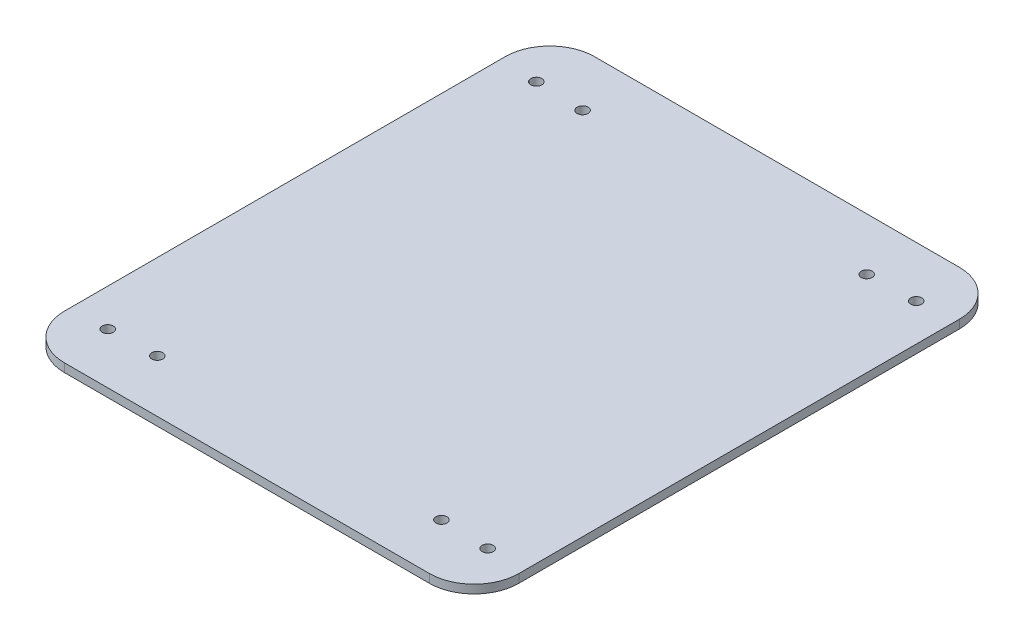
from build123d import *

# Parameters (mm, degrees)
SKETCH2_W               = 152.4
SKETCH2_H               = 177.8
BOSS_EXTRUDE2_DEPTH     = 2.85
SKETCH3_R               = 1.85
CUT_EXTRUDE1_DEPTH      = 118.188619328
MIRROR2_COPY_1_SKETCH_R = 1.85
MIRROR2_COPY_1_DEPTH    = 118.188619328
FILLET1_R               = 15


with BuildPart() as part:
    # Sketch2 → Boss-Extrude2 (new body)
    with BuildSketch(Plane(origin=(0, 0, 0), x_dir=(1, 0, 0), z_dir=(0, 1, 0))):
        Rectangle(SKETCH2_W, SKETCH2_H)
    extrude(amount=BOSS_EXTRUDE2_DEPTH)

    # Sketch3 → Cut-Extrude1 (cut, through all)
    with BuildSketch(Plane.XZ.offset(2)):
        with Locations(Location((-63.7, 71.86030802, 0), (0, 0, 270))):
            Circle(SKETCH3_R)
        with Locations(Location((-47.633605072, 71.30556155, 0), (0, 0, 270))):
            Circle(SKETCH3_R)
    cut_extrude1 = extrude(amount=-CUT_EXTRUDE1_DEPTH, mode=Mode.SUBTRACT)

    # Mirror1: Cut-Extrude1 across plane
    add(cut_extrude1.mirror(Plane.XY), mode=Mode.SUBTRACT)

    # Mirror2: Cut-Extrude1 across plane
    add(cut_extrude1.mirror(Plane(origin=(0, 0, 0), x_dir=(0, 0, 1), z_dir=(1, 0, 0))), mode=Mode.SUBTRACT)

    # Mirror2 copy 1 sketch → Mirror2 copy 1 (cut, through all)
    with BuildSketch(Plane(origin=(0, -2, 0), x_dir=(-1, 0, 0), z_dir=(0, -1, 0))):
        with Locations(Location((-63.7, 71.86030802, 0), (0, 0, 270))):
            Circle(MIRROR2_COPY_1_SKETCH_R)
        with Locations(Location((-47.633605072, 71.30556155, 0), (0, 0, 270))):
            Circle(MIRROR2_COPY_1_SKETCH_R)
    extrude(amount=-MIRROR2_COPY_1_DEPTH, mode=Mode.SUBTRACT)

    # Fillet1
    fillet1_edges = [part.edges().sort_by_distance(p)[0] for p in [
        (76.2, 1.425, 88.9),
        (-76.2, 1.425, 88.9),
        (-76.2, 1.425, -88.9),
        (76.2, 1.425, -88.9),
    ]]
    fillet(fillet1_edges, radius=FILLET1_R)


solid = part.part
